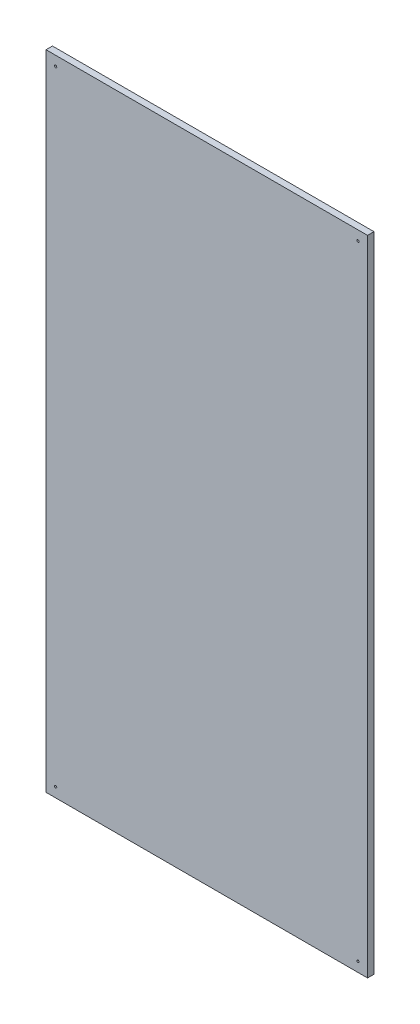
from build123d import *

# Parameters (mm, degrees)
ESQUISSE1_W        = 500
ESQUISSE1_H        = 1000
ESQUISSE1_R        = 1.75
BOSS_EXTRU_1_DEPTH = 10


with BuildPart() as part:
    # Esquisse1 → Boss.-Extru.1 (new body)
    with BuildSketch(Plane.XY):
        Rectangle(ESQUISSE1_W, ESQUISSE1_H)
        with Locations((235, 485)):
            Circle(ESQUISSE1_R, mode=Mode.SUBTRACT)
        with Locations(Location((235, -485, 0), (0, 0, 180))):
            Circle(ESQUISSE1_R, mode=Mode.SUBTRACT)
        with Locations((-235, -485)):
            Circle(ESQUISSE1_R, mode=Mode.SUBTRACT)
        with Locations(Location((-235, 485, 0), (0, 0, 180))):
            Circle(ESQUISSE1_R, mode=Mode.SUBTRACT)
    extrude(amount=BOSS_EXTRU_1_DEPTH)


solid = part.part
